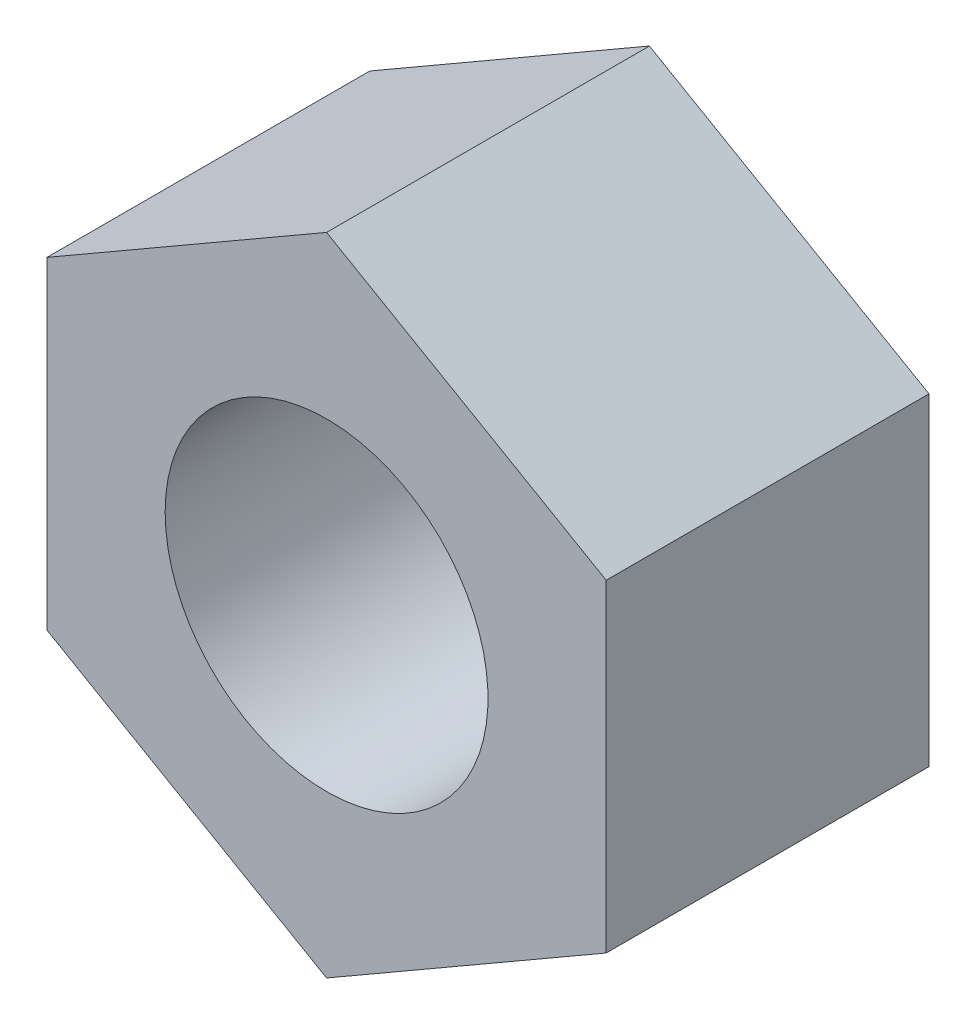
from build123d import *

# Parameters (mm, degrees)
BOSS_EXTRUDE1_DEPTH = 3
SKETCH2_R           = 1.5
CUT_EXTRUDE1_DEPTH  = 3


with BuildPart() as part:
    # Sketch1 → Boss-Extrude1 (new body)
    with BuildSketch(Plane.XY):
        Polygon((0, 3), (-2.598076211, 1.5), (-2.598076211, -1.5), (0, -3), (2.598076211, -1.5), (2.598076211, 1.5), align=None)
    extrude(amount=BOSS_EXTRUDE1_DEPTH)

    # Sketch2 → Cut-Extrude1 (cut)
    with BuildSketch(Plane(origin=(0, 0, 0), x_dir=(-1, 0, 0), z_dir=(0, 0, -1))):
        Circle(SKETCH2_R)
    extrude(amount=-CUT_EXTRUDE1_DEPTH, mode=Mode.SUBTRACT)


solid = part.part
